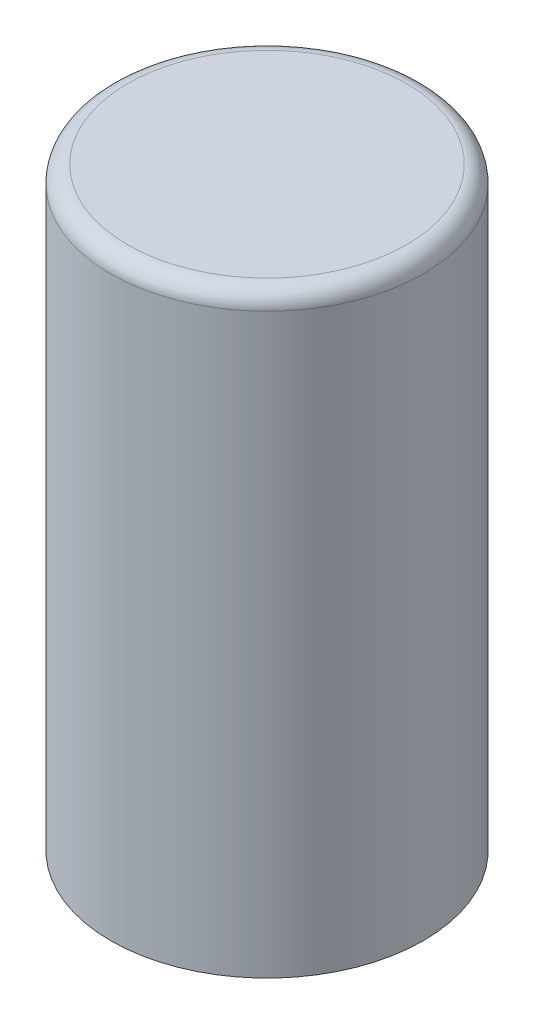
from build123d import *

# Parameters (mm, degrees)
FILLET1_R = 0.127


with BuildPart() as part:
    # Sketch1 → Revolve1 (revolve)
    with BuildSketch(Plane.XY, mode=Mode.PRIVATE) as revolve1_sk:
        Polygon((0, 5.17144), (1.1811, 5.17144), (1.1811, 0.681908403), (0, 0), align=None)
    revolve(revolve1_sk.sketch.rotate(Axis((0, 0, 0), (0, 1, 0)), 90), axis=Axis((0, 0, 0), (0, 1, 0)))

    # Fillet1
    fillet1_edges = [part.edges().sort_by_distance(p)[0] for p in [
        (0, 5.17144, 1.1811),
    ]]
    fillet(fillet1_edges, radius=FILLET1_R)


solid = part.part
